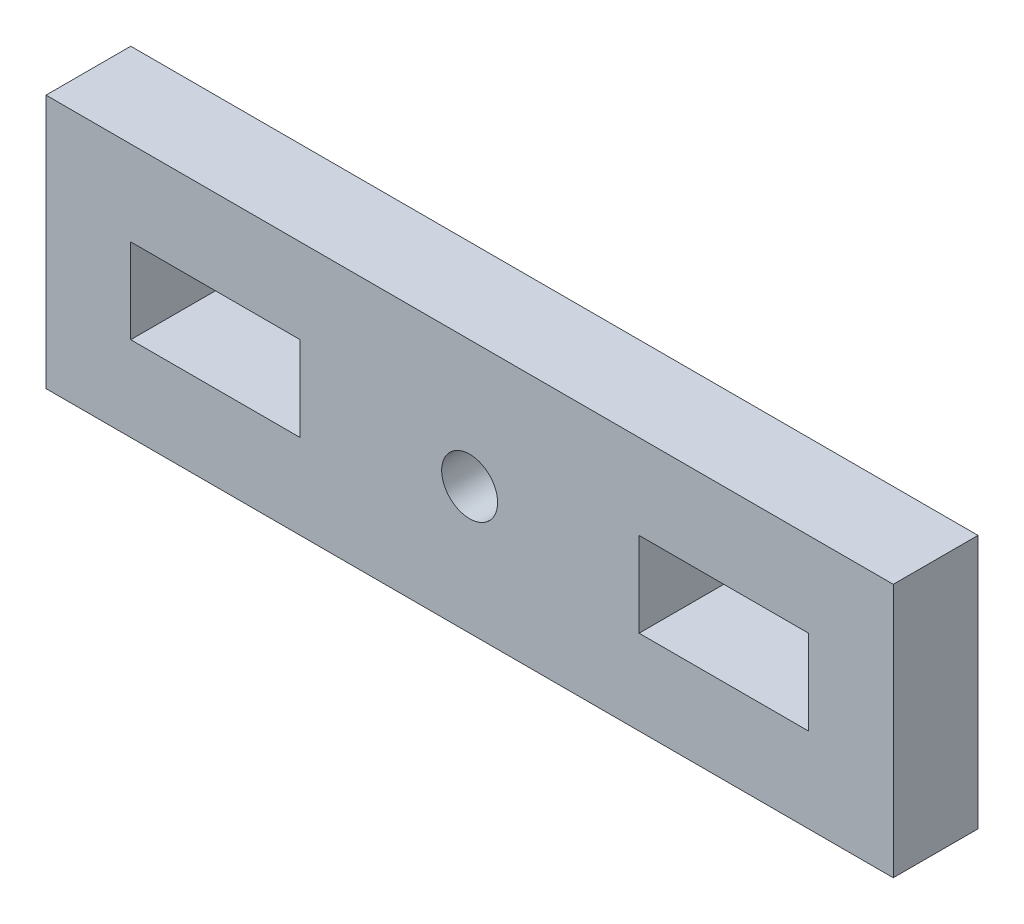
from build123d import *

# Parameters (mm, degrees)
SKETCH1_W           = 63.5
SKETCH1_H           = 19.05
BOSS_EXTRUDE1_DEPTH = 6.35
SKETCH2_R           = 2.0955
SKETCH2_W           = 12.7
SKETCH2_H           = 6.35
CUT_EXTRUDE1_DEPTH  = 6.35


with BuildPart() as part:
    # Sketch1 → Boss-Extrude1 (new body)
    with BuildSketch(Plane.XY):
        Rectangle(SKETCH1_W, SKETCH1_H)
    extrude(amount=BOSS_EXTRUDE1_DEPTH)

    # Sketch2 → Cut-Extrude1 (cut)
    with BuildSketch(Plane.XY.offset(6.35)):
        Circle(SKETCH2_R)
        with Locations((-19.05, 0)):
            Rectangle(SKETCH2_W, SKETCH2_H)
        with Locations((19.05, 0)):
            Rectangle(SKETCH2_W, SKETCH2_H)
    extrude(amount=-CUT_EXTRUDE1_DEPTH, mode=Mode.SUBTRACT)


solid = part.part
